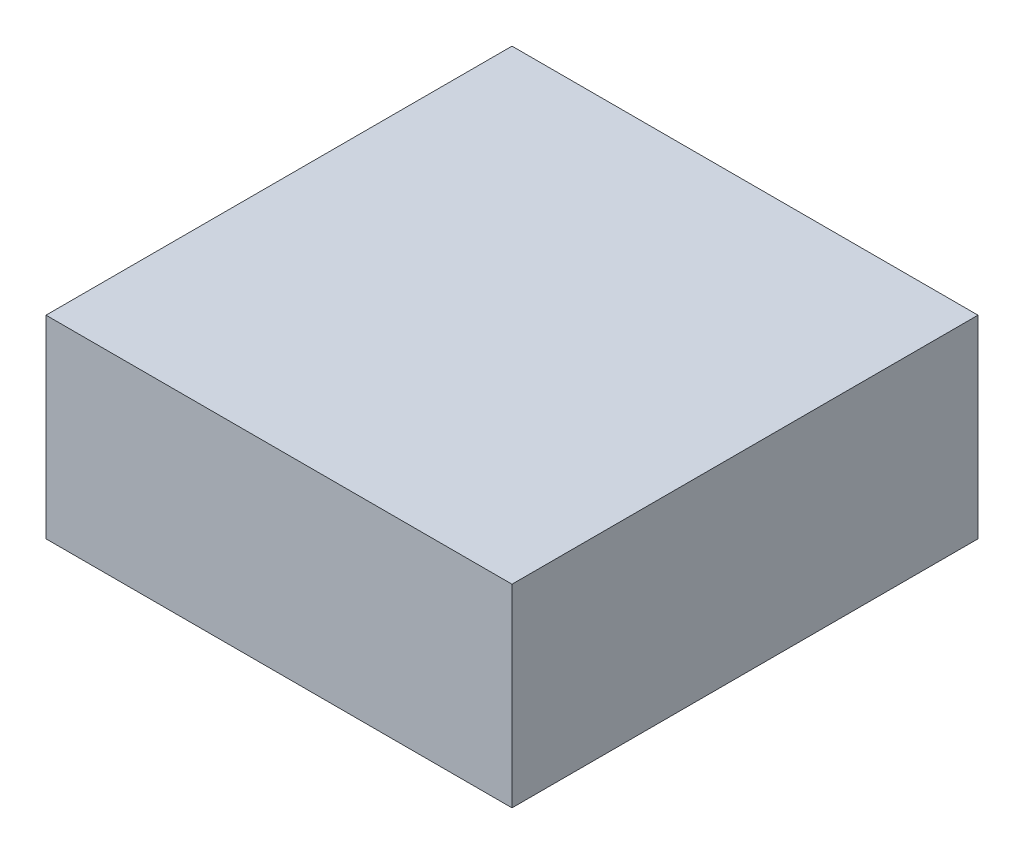
from build123d import *

# Parameters (mm, degrees)
SKETCH1_W           = 43.3
SKETCH1_H           = 43.3
BOSS_EXTRUDE1_DEPTH = 18


with BuildPart() as part:
    # Sketch1 → Boss-Extrude1 (new body)
    with BuildSketch(Plane(origin=(0, 0, 0), x_dir=(1, 0, 0), z_dir=(0, 1, 0))):
        with Locations((21.65, 21.65)):
            Rectangle(SKETCH1_W, SKETCH1_H)
    extrude(amount=BOSS_EXTRUDE1_DEPTH)


solid = part.part
